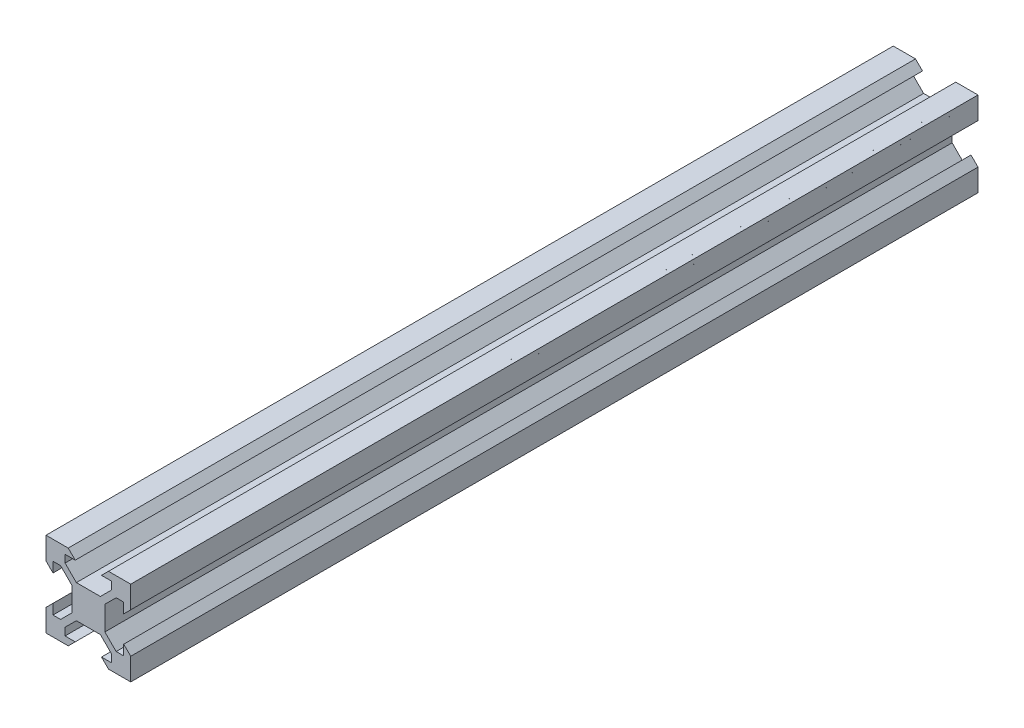
from build123d import *

# Parameters (mm, degrees)
BOSS_EXTRUDE1_DEPTH = 200


with BuildPart() as part:
    # Sketch1 → Boss-Extrude1 (new body)
    with BuildSketch(Plane.XY):
        Polygon((2.834320347, 3.893970342), (-2.834320347, 3.893970342), (-5.5, 6.558849663), (-5.5, 8.349069506), (-3.1, 8.349069506), (-4.75, 9.998574117), (-10, 9.998574117), (-10, 4.746997406), (-8.35, 3.097492795), (-8.350720674, 5.497492687), (-6.560500912, 5.498030255), (-3.894821259, 2.833150935), (-3.894821259, -2.833150935), (-6.560500912, -5.498030255), (-8.350720674, -5.497492687), (-8.35, -3.097492795), (-10, -4.746997406), (-10, -9.998574117), (-4.75, -9.998574117), (-3.1, -8.349069506), (-5.5, -8.349069506), (-5.5, -6.558849663), (-2.834320347, -3.893970342), (2.834320347, -3.893970342), (5.5, -6.558849663), (5.5, -8.349069506), (3.1, -8.349069506), (4.75, -9.998574117), (10, -9.998574117), (10, -4.746997406), (8.35, -3.097492795), (8.350720674, -5.497492687), (6.560500912, -5.498030255), (3.894821259, -2.833150935), (3.894821259, 2.833150935), (6.560500912, 5.498030255), (8.350720674, 5.497492687), (8.35, 3.097492795), (10, 4.746997406), (10, 9.998574117), (4.75, 9.998574117), (3.1, 8.349069506), (5.5, 8.349069506), (5.5, 6.558849663), align=None)
    extrude(amount=BOSS_EXTRUDE1_DEPTH)


solid = part.part
